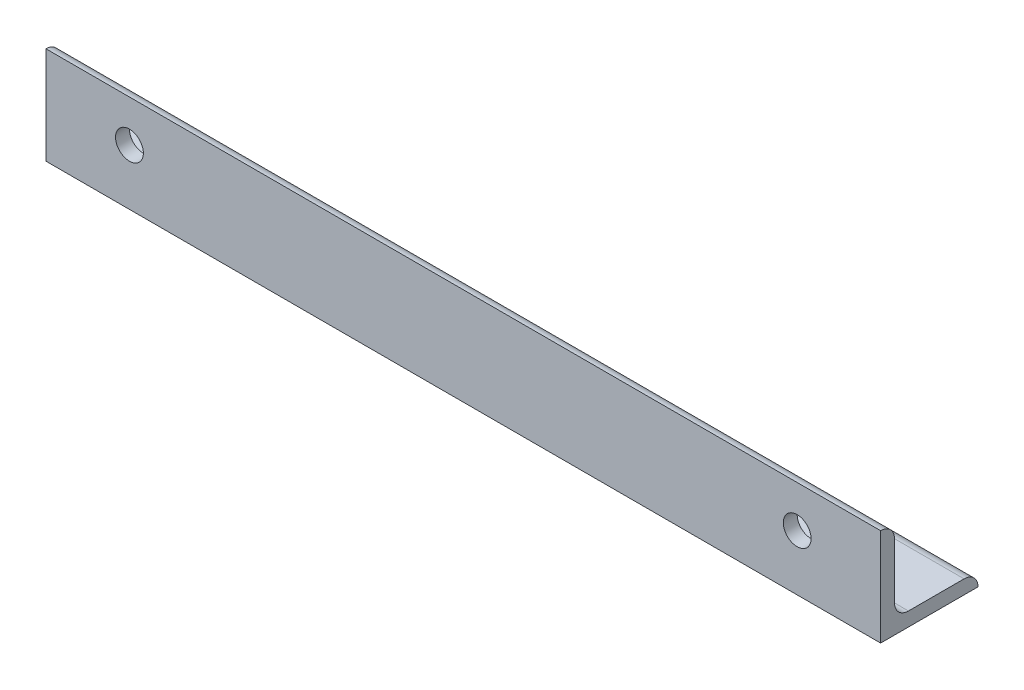
from build123d import *

# Parameters (mm, degrees)
K_TOWNIK_STALOWY_35_X_35_X_5_1_DEPTH = 300
SZKIC2_R                             = 5
WYTNIJ_WYCI_GNI_CIE1_DEPTH           = 304.521004216


with BuildPart() as part:
    # Sketch1 → Kątownik stalowy 35 X 35 X 5(1) (new body)
    with BuildSketch(Plane(origin=(0, 0, 0), x_dir=(0, 0, -1), z_dir=(1, 0, 0))):
        with BuildLine():
            Line((0, 0), (0, 35))
            ThreePointArc((0, 35), (3.535533906, 33.535533906), (5, 30))
            Line((5, 30), (5, 10))
            ThreePointArc((5, 10), (6.464466094, 6.464466094), (10, 5))
            Line((10, 5), (30, 5))
            ThreePointArc((30, 5), (33.535533906, 3.535533906), (35, 0))
            Line((35, 0), (0, 0))
        make_face()
    extrude(amount=K_TOWNIK_STALOWY_35_X_35_X_5_1_DEPTH)

    # Szkic2 → Wytnij-wyciągnięcie1 (cut, through all)
    with BuildSketch(Plane(origin=(0, 0, -5), x_dir=(-1, 0, 0), z_dir=(0, 0, -1))):
        with Locations(Location((-270, 20, 0), (0, 0, 90))):
            Circle(SZKIC2_R)
        with Locations(Location((-30, 20, 0), (0, 0, 90))):
            Circle(SZKIC2_R)
    extrude(amount=-WYTNIJ_WYCI_GNI_CIE1_DEPTH, mode=Mode.SUBTRACT)


solid = part.part
